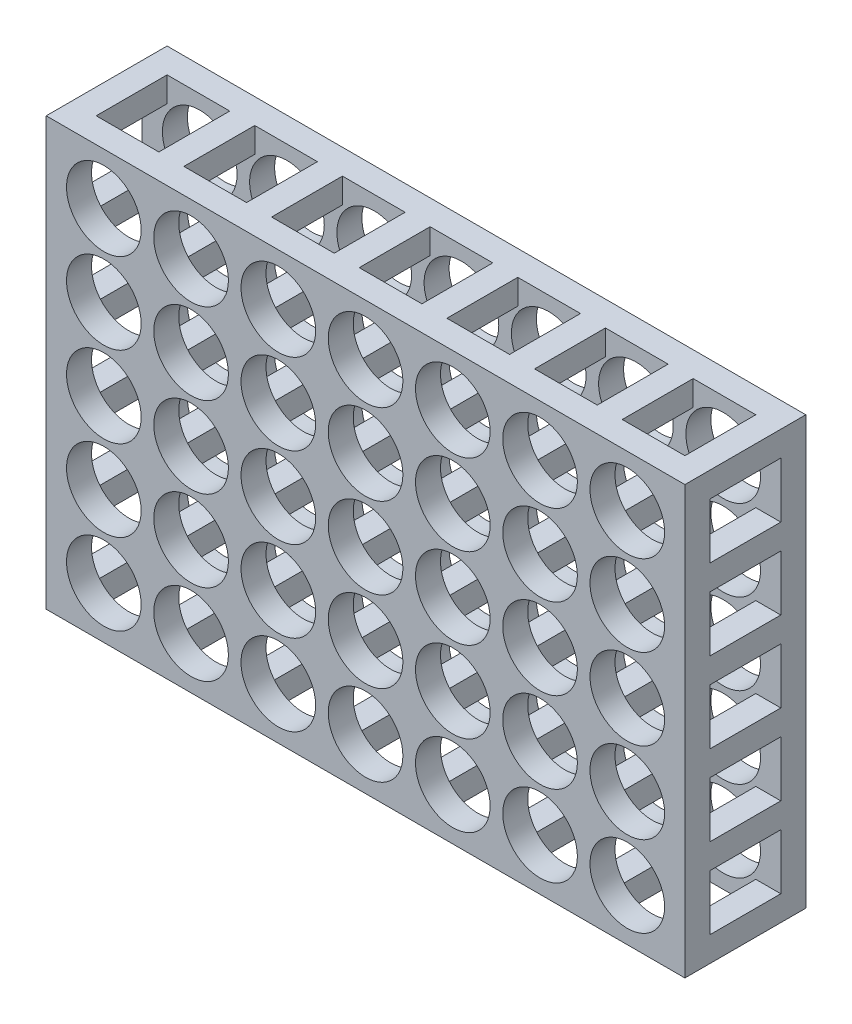
from build123d import *

# Parameters (mm, degrees)
SKETCH1_W            = 127.76
SKETCH1_H            = 85.48
BOSS_EXTRUDE1_DEPTH  = 5
SKETCH2_R            = 7.465
CUT_EXTRUDE1_DEPTH   = 95.825210988
SKETCH3_W            = 5
SKETCH3_H            = 5
BOSS_EXTRUDE2_DEPTH  = 7.09
LPATTERN2_COUNT      = 7
LPATTERN2_PITCH      = 17.45125
LPATTERN2_COUNT_DIR2 = 5
LPATTERN2_PITCH_DIR2 = 16.221666667
LPATTERN5_COUNT      = 8
LPATTERN5_PITCH      = 17.537142857
LPATTERN5_COUNT_DIR2 = 6
LPATTERN5_PITCH_DIR2 = 16.096


with BuildPart() as part:
    # Sketch1 → Boss-Extrude1 (new body)
    with BuildSketch(Plane.XY):
        with Locations((9.206235294, -17.469823529)):
            Rectangle(SKETCH1_W, SKETCH1_H)
    extrude(amount=BOSS_EXTRUDE1_DEPTH)

    # Sketch2 → Cut-Extrude1 (cut, through all)
    with BuildSketch(Plane.XY.offset(5)):
        with Locations((-43.147514706, 14.973509804)):
            Circle(SKETCH2_R)
    cut_extrude1 = extrude(amount=-CUT_EXTRUDE1_DEPTH, mode=Mode.SUBTRACT)

    # Sketch3 → Boss-Extrude2 (add)
    with BuildSketch(Plane.XY.offset(5)):
        with Locations((-52.173764706, 22.770176471)):
            Rectangle(SKETCH3_W, SKETCH3_H)
    boss_extrude2 = extrude(amount=BOSS_EXTRUDE2_DEPTH)

    # LPattern2: Cut-Extrude1 7 × 5
    with Locations(*[(i * LPATTERN2_PITCH, -j * LPATTERN2_PITCH_DIR2, 0) for i in range(LPATTERN2_COUNT) for j in range(LPATTERN2_COUNT_DIR2) if (i, j) != (0, 0)]):
        add(cut_extrude1, mode=Mode.SUBTRACT)

    # LPattern5: Boss-Extrude2 8 × 6
    with Locations(*[(i * LPATTERN5_PITCH, -j * LPATTERN5_PITCH_DIR2, 0) for i in range(LPATTERN5_COUNT) for j in range(LPATTERN5_COUNT_DIR2) if (i, j) != (0, 0)]):
        add(boss_extrude2)

    # Mirror9: part across plane


with BuildPart() as part_1:
    add(part.part)
    add(part.part.mirror(Plane(origin=(0, 0, 12.09), x_dir=(1, 0, 0), z_dir=(0, 0, -1))))


solid = part_1.part
